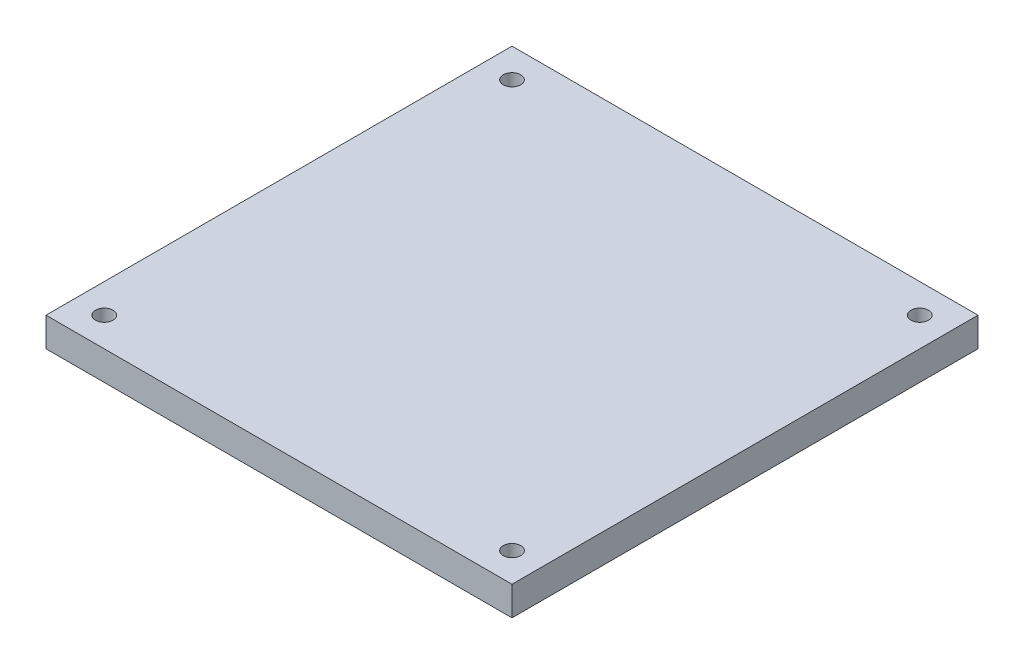
from build123d import *

# Parameters (mm, degrees)
ESQUISSE1_W             = 80
ESQUISSE1_H             = 80
BOSS_EXTRU_1_DEPTH      = 5
ESQUISSE2_R             = 1.5
ENL_V_MAT_EXTRU_1_DEPTH = 57.789083458


with BuildPart() as part:
    # Esquisse1 → Boss.-Extru.1 (new body)
    with BuildSketch(Plane(origin=(0, 0, 0), x_dir=(1, 0, 0), z_dir=(0, 1, 0))):
        Rectangle(ESQUISSE1_W, ESQUISSE1_H)
    extrude(amount=BOSS_EXTRU_1_DEPTH)

    # Esquisse2 → Enlèv. mat.-Extru.1 (cut, through all)
    with BuildSketch(Plane(origin=(0, 5, 0), x_dir=(1, 0, 0), z_dir=(0, 1, 0))):
        with Locations(Location((-35, 35, 0), (0, 0, 270))):
            Circle(ESQUISSE2_R)
        with Locations(Location((35, -35, 0), (0, 0, 270))):
            Circle(ESQUISSE2_R)
        with Locations(Location((-35, -35, 0), (0, 0, 270))):
            Circle(ESQUISSE2_R)
        with Locations(Location((35, 35, 0), (0, 0, 270))):
            Circle(ESQUISSE2_R)
    extrude(amount=-ENL_V_MAT_EXTRU_1_DEPTH, mode=Mode.SUBTRACT)


solid = part.part
